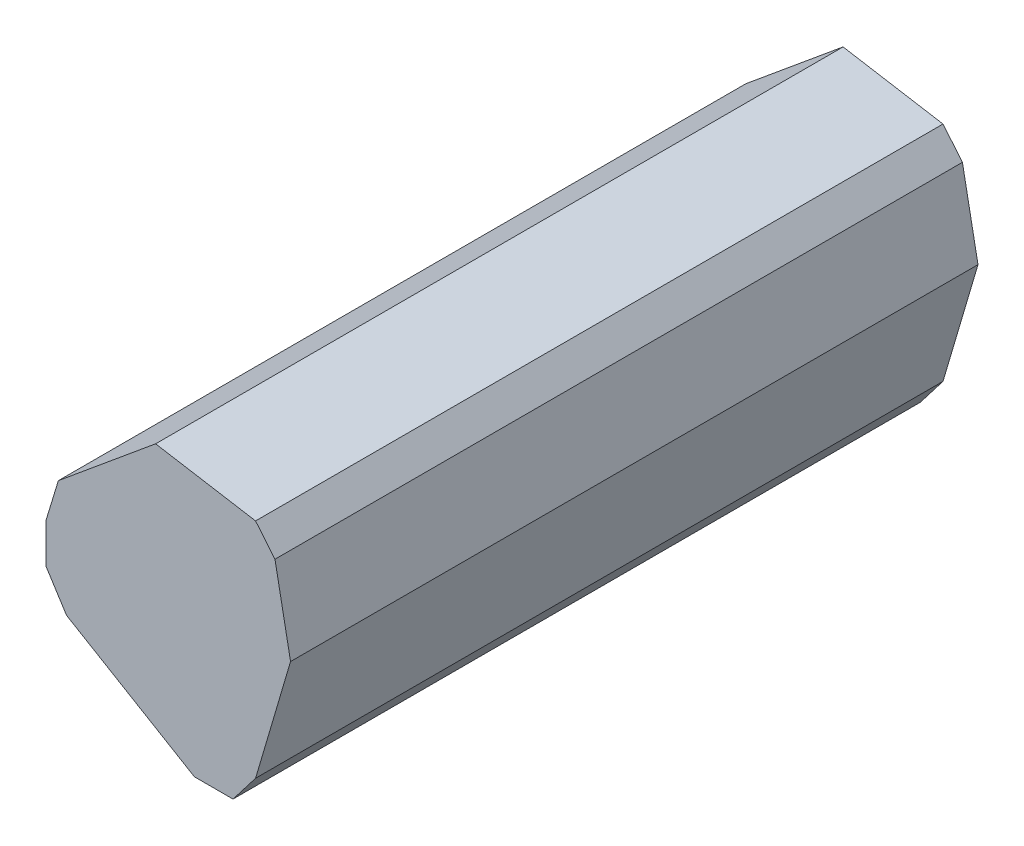
from build123d import *

# Parameters (mm, degrees)
BOSS_EXTRU_1_DEPTH = 30


with BuildPart() as part:
    # Esquisse1 → Boss.-Extru.1 (new body)
    with BuildSketch(Plane.XY):
        Polygon((0, -6.822925201), (4.244094295, -3.30929812), (8.605674918, -4.042577855), (9.453044427, -5.066111661), (10.13244188, -8.594550769), (8.605674918, -13.768477871), (7.622323994, -15.047377265), (5.93702204, -15.047377265), (0.35570281, -11.735145544), (-0.539610729, -10.330063788), (-0.539610729, -8.594550769), align=None)
    extrude(amount=BOSS_EXTRU_1_DEPTH)


solid = part.part
